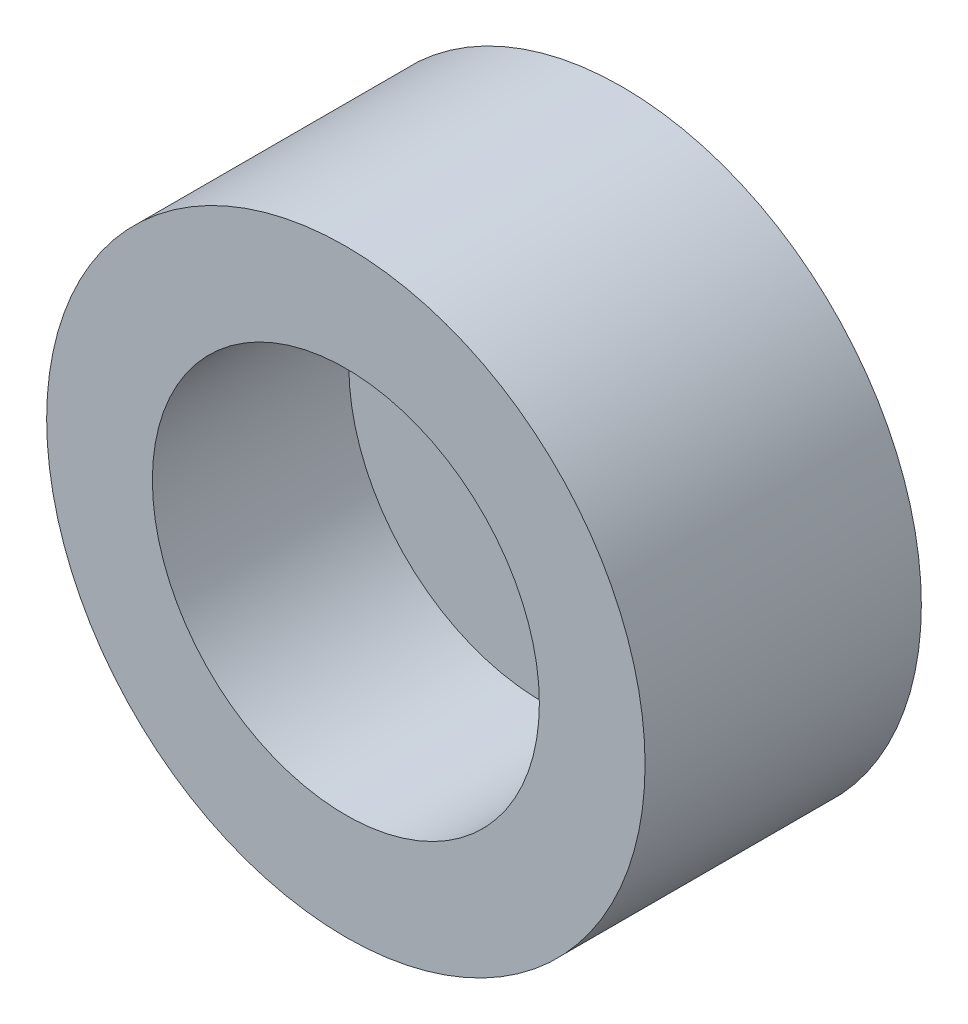
from build123d import *

# Parameters (mm, degrees)
SKETCH2_R           = 7.5
BOSS_EXTRUDE1_DEPTH = 2
SKETCH3_R           = 7.5
SKETCH3_R_2         = 4.85
BOSS_EXTRUDE2_DEPTH = 4.925


with BuildPart() as part:
    # Sketch2 → Boss-Extrude1 (new body)
    with BuildSketch(Plane.XY):
        Circle(SKETCH2_R)
    extrude(amount=BOSS_EXTRUDE1_DEPTH)

    # Sketch3 → Boss-Extrude2 (add)
    with BuildSketch(Plane.XY.offset(2)):
        Circle(SKETCH3_R)
        Circle(SKETCH3_R_2, mode=Mode.SUBTRACT)
    extrude(amount=BOSS_EXTRUDE2_DEPTH)


solid = part.part
